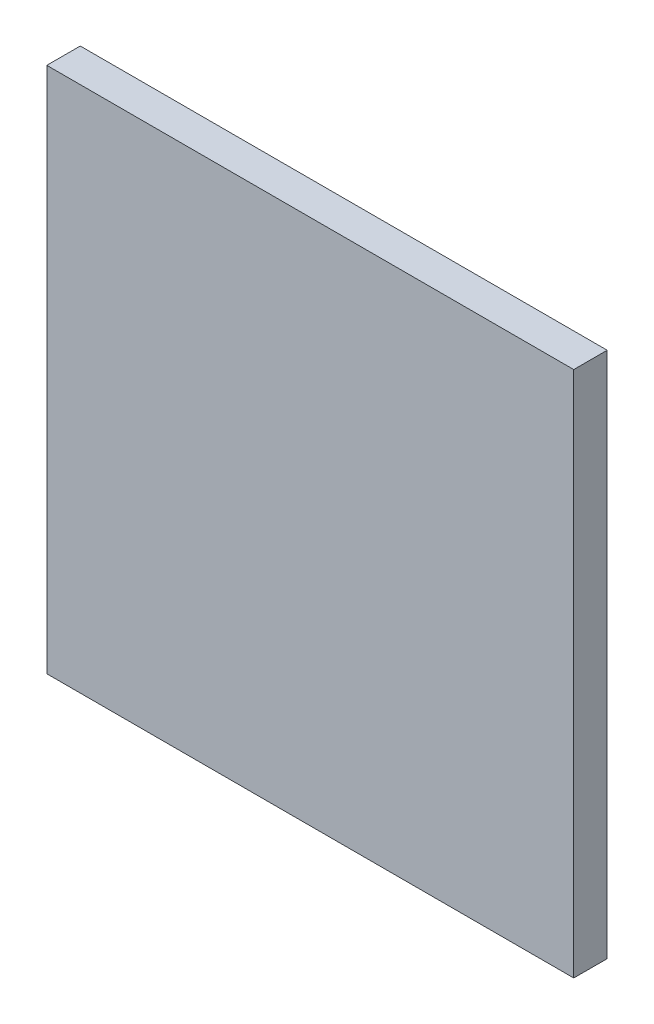
from build123d import *

# Parameters (mm, degrees)
SKETCH1_W           = 100
SKETCH1_H           = 100
BOSS_EXTRUDE1_DEPTH = 6.35


with BuildPart() as part:
    # Sketch1 → Boss-Extrude1 (new body)
    with BuildSketch(Plane.XY):
        with Locations((6.71641791, -23.81840796)):
            Rectangle(SKETCH1_W, SKETCH1_H)
    extrude(amount=BOSS_EXTRUDE1_DEPTH)


solid = part.part
